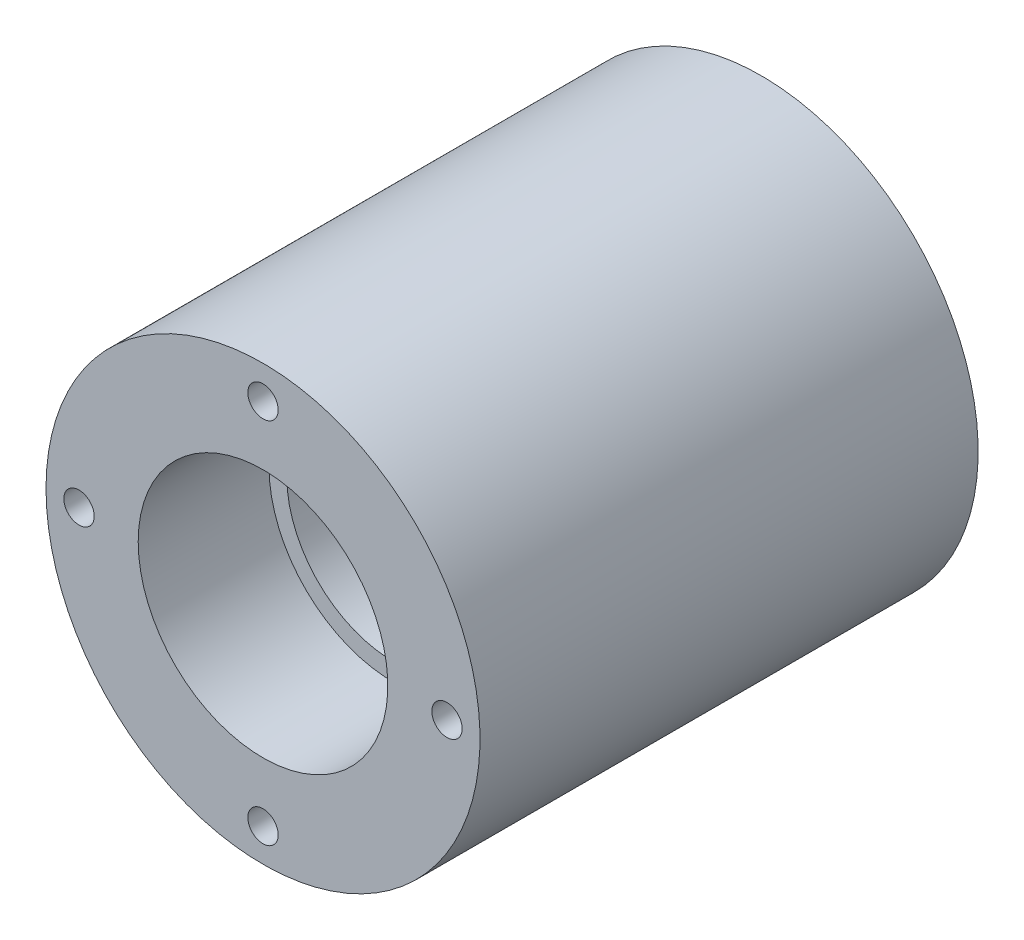
from build123d import *

# Parameters (mm, degrees)
TAP_DRILL_FOR_1_4_20_TAP2_AT_2_COUNT = 2
TAP_DRILL_FOR_1_4_20_TAP2_AT_2_PITCH = 43.780544641
TAP_DRILL_FOR_1_4_20_TAP2_AT_3_COUNT = 2
TAP_DRILL_FOR_1_4_20_TAP2_AT_3_PITCH = 61.91504
TAP_DRILL_FOR_1_4_20_TAP2_AT_4_COUNT = 2
TAP_DRILL_FOR_1_4_20_TAP2_AT_4_PITCH = 43.780544641


with BuildPart() as part:
    # Housing Sketch → Housing Revolve (revolve)
    with BuildSketch(Plane(origin=(0, 0, 0), x_dir=(0, 0, -1), z_dir=(1, 0, 0)), mode=Mode.PRIVATE) as housing_revolve_sk:
        Polygon((83.82, 36.5125), (0, 36.5125), (0, 21), (22, 21), (22, 18), (55.945, 18), (55.945, 21), (83.82, 21), align=None)
    revolve(housing_revolve_sk.sketch.rotate(Axis((0, 0, -141.5522592), (0, 0, 1)), 90), axis=Axis((0, 0, -141.5522592), (0, 0, 1)))

    # Sketch8 → Tap Drill for 1/4-20 Tap2 (revolve, cut)
    with BuildSketch(Plane(origin=(0, 30.95752, 0), x_dir=(0, -1, 0), z_dir=(1, 0, 0))):
        Polygon((0, 0), (0, 14.233816902), (2.5527, 12.7), (2.5527, 0), align=None)
    tap_drill_for_1_4_20_tap2 = revolve(axis=Axis((0, 30.95752, 6.35), (0, 0, -1)), mode=Mode.SUBTRACT)

    # Tap Drill for 1/4-20 Tap2 at 2: Tap Drill for 1/4-20 Tap2 ×2
    with Locations(*[Vector(0.7071067811865476, -0.7071067811865476, 0) * (i * TAP_DRILL_FOR_1_4_20_TAP2_AT_2_PITCH) for i in range(1, TAP_DRILL_FOR_1_4_20_TAP2_AT_2_COUNT)]):
        add(tap_drill_for_1_4_20_tap2, mode=Mode.SUBTRACT)

    # Tap Drill for 1/4-20 Tap2 at 3: Tap Drill for 1/4-20 Tap2 ×2
    with Locations(*[(0, -i * TAP_DRILL_FOR_1_4_20_TAP2_AT_3_PITCH, 0) for i in range(1, TAP_DRILL_FOR_1_4_20_TAP2_AT_3_COUNT)]):
        add(tap_drill_for_1_4_20_tap2, mode=Mode.SUBTRACT)

    # Tap Drill for 1/4-20 Tap2 at 4: Tap Drill for 1/4-20 Tap2 ×2
    with Locations(*[Vector(-0.7071067811865476, -0.7071067811865476, 0) * (i * TAP_DRILL_FOR_1_4_20_TAP2_AT_4_PITCH) for i in range(1, TAP_DRILL_FOR_1_4_20_TAP2_AT_4_COUNT)]):
        add(tap_drill_for_1_4_20_tap2, mode=Mode.SUBTRACT)

    # Mirror1: Tap Drill for 1/4-20 Tap2 across plane
    add(tap_drill_for_1_4_20_tap2.mirror(Plane(origin=(0, 0, -41.91), x_dir=(1, 0, 0), z_dir=(0, 0, -1))), mode=Mode.SUBTRACT)

    # Mirror1 copy 1 sketch → Mirror1 copy 1 (revolve, cut)
    with BuildSketch(Plane(origin=(30.95752, 0, -83.82), x_dir=(0, -1, 0), z_dir=(1, 0, 0))):
        Polygon((0, 0), (0, -14.233816902), (2.5527, -12.7), (2.5527, 0), align=None)
    revolve(axis=Axis((30.95752, 0, -90.17), (0, 0, -1)), mode=Mode.SUBTRACT)

    # Mirror1 copy 2 sketch → Mirror1 copy 2 (revolve, cut)
    with BuildSketch(Plane(origin=(0, -30.95752, -83.82), x_dir=(0, -1, 0), z_dir=(1, 0, 0))):
        Polygon((0, 0), (0, -14.233816902), (2.5527, -12.7), (2.5527, 0), align=None)
    revolve(axis=Axis((0, -30.95752, -90.17), (0, 0, -1)), mode=Mode.SUBTRACT)

    # Mirror1 copy 3 sketch → Mirror1 copy 3 (revolve, cut)
    with BuildSketch(Plane(origin=(-30.95752, 0, -83.82), x_dir=(0, -1, 0), z_dir=(1, 0, 0))):
        Polygon((0, 0), (0, -14.233816902), (2.5527, -12.7), (2.5527, 0), align=None)
    revolve(axis=Axis((-30.95752, 0, -90.17), (0, 0, -1)), mode=Mode.SUBTRACT)


solid = part.part
